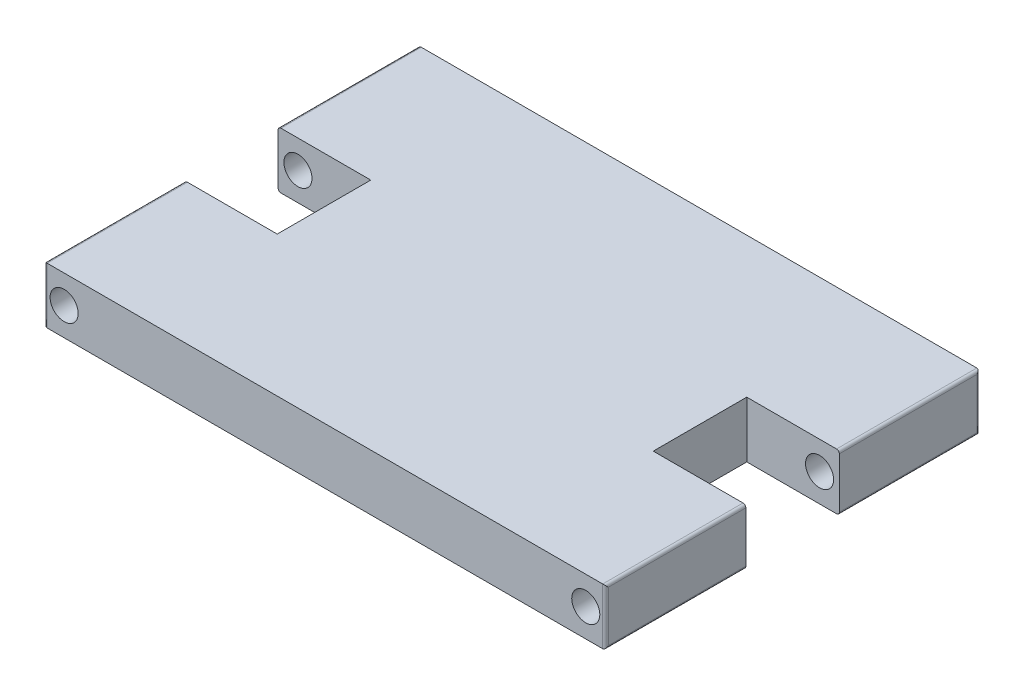
from build123d import *

# Parameters (mm, degrees)
ESTRUSIONE_ESTRUSIONE1_DEPTH  = 60
TAGLIO_ESTRUSIONE2_DEPTH      = 724.602100605
TAGLIO_ESTRUSIONE2_DEPTH_BACK = 724.602100605
SCHIZZO3_OUTSIDE_W            = 746.72
SCHIZZO3_OUTSIDE_H            = 206.72
SCHIZZO3_OUTSIDE_R            = 15
SCHIZZO4_W                    = 100
SCHIZZO4_H                    = 100
TAGLIO_ESTRUSIONE3_DEPTH      = 724.602100605


with BuildPart() as part:
    # Schizzo1 → Estrusione-Estrusione1 (new body)
    with BuildSketch(Plane(origin=(0, 0, 0), x_dir=(1, 0, 0), z_dir=(0, 1, 0))):
        with BuildLine():
            Line((3, 0), (597, 0))
            ThreePointArc((597, 0), (599.121320344, 0.878679656), (600, 3))
            Line((600, 3), (600, 397))
            ThreePointArc((600, 397), (599.121320344, 399.121320344), (597, 400))
            Line((597, 400), (3, 400))
            ThreePointArc((3, 400), (0.878679656, 399.121320344), (0, 397))
            Line((0, 397), (0, 3))
            ThreePointArc((0, 3), (0.878679656, 0.878679656), (3, 0))
        make_face()
    extrude(amount=ESTRUSIONE_ESTRUSIONE1_DEPTH)

    # Schizzo3 outside → Taglio-Estrusione2 (cut, two sides: drawn at the far end of the back side and taken through both)
    # profile 1 of 3: a face of its own
    with BuildSketch(Plane.XY.offset(-TAGLIO_ESTRUSIONE2_DEPTH_BACK)):
        with Locations((300, 30)):
            Rectangle(SCHIZZO3_OUTSIDE_W, SCHIZZO3_OUTSIDE_H)
        with BuildLine():
            Line((3, 60), (597, 60))
            ThreePointArc((597, 60), (599.121320344, 59.121320344), (600, 57))
            Line((600, 57), (600, 3))
            ThreePointArc((600, 3), (599.121320344, 0.878679656), (597, 0))
            Line((597, 0), (3, 0))
            ThreePointArc((3, 0), (0.878679656, 0.878679656), (0, 3))
            Line((0, 3), (0, 57))
            ThreePointArc((0, 57), (0.878679656, 59.121320344), (3, 60))
        make_face(mode=Mode.SUBTRACT)
    # profile 2 of 3: a face of its own
    with BuildSketch(Plane.XY.offset(-TAGLIO_ESTRUSIONE2_DEPTH_BACK)):
        with Locations((21.15, 30)):
            Circle(SCHIZZO3_OUTSIDE_R)
    # profile 3 of 3: a face of its own
    with BuildSketch(Plane.XY.offset(-TAGLIO_ESTRUSIONE2_DEPTH_BACK)):
        with Locations((578.85, 30)):
            Circle(SCHIZZO3_OUTSIDE_R)
    extrude(amount=TAGLIO_ESTRUSIONE2_DEPTH + TAGLIO_ESTRUSIONE2_DEPTH_BACK, mode=Mode.SUBTRACT)

    # Schizzo4 → Taglio-Estrusione3 (cut, through all)
    with BuildSketch(Plane(origin=(0, 0, 0), x_dir=(1, 0, 0), z_dir=(0, 1, 0))):
        with Locations((49, 200)):
            Rectangle(SCHIZZO4_W, SCHIZZO4_H)
        with Locations((551, 200)):
            Rectangle(SCHIZZO4_W, SCHIZZO4_H)
    extrude(amount=TAGLIO_ESTRUSIONE3_DEPTH, mode=Mode.SUBTRACT)


solid = part.part
